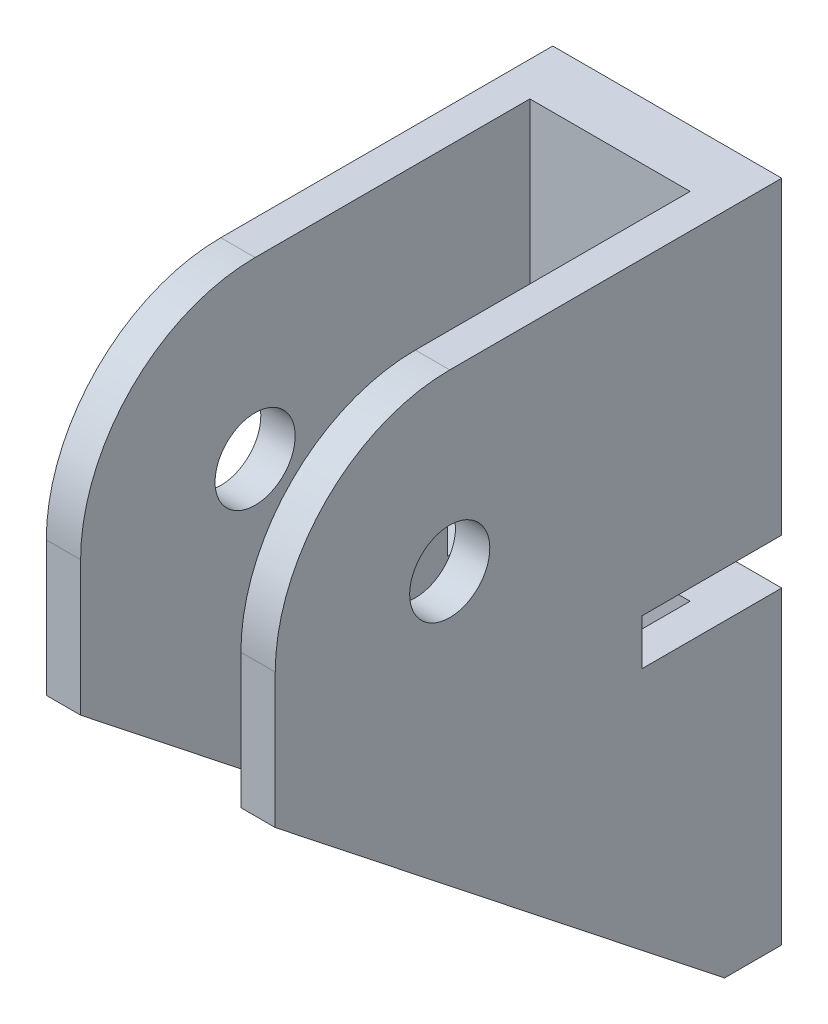
from build123d import *

# Parameters (mm, degrees)
SKETCH1_W             = 10
SKETCH1_H             = 13.5
SKETCH1_R             = 1.75
BOSS_EXTRUDE1_DEPTH   = 2.5
BOSS_EXTRUDE1_2_DEPTH = 2.5
BOSS_EXTRUDE2_DEPTH   = 1.5
SKETCH5_R             = 1.7499965
CUT_EXTRUDE1_DEPTH    = 12.446


with BuildPart() as part:
    # Sketch1 → Boss-Extrude1 (new body)
    with BuildSketch(Plane.XY):
        with Locations((8.63063628, 74.671921363)):
            Rectangle(SKETCH1_W, SKETCH1_H)
        with Locations((8.63063628, 74.421921363)):
            Circle(SKETCH1_R, mode=Mode.SUBTRACT)
    extrude(amount=BOSS_EXTRUDE1_DEPTH)



with BuildPart() as body_2:
    # Sketch1 → Boss-Extrude1 2 (new body)
    with BuildSketch(Plane.XY):
        with Locations((8.63063628, 59.171921363)):
            Rectangle(SKETCH1_W, SKETCH1_H)
        with Locations((8.63063628, 59.921921363)):
            Circle(SKETCH1_R, mode=Mode.SUBTRACT)
    extrude(amount=BOSS_EXTRUDE1_2_DEPTH)


with BuildPart() as part_1:
    add(part.part)

    add(body_2.part)  # Boss-Extrude2 merges body 2
    # Sketch2 → Boss-Extrude2 (add)
    with BuildSketch(Plane.ZY.offset(-3.63063628)):
        with BuildLine():
            Line((6.100159914, 65.921921363), (2.5, 65.921921363))
            Line((2.5, 65.921921363), (2.5, 52.421921363))
            Line((2.5, 52.421921363), (22.12, 67.921921363))
            Line((22.12, 67.921921363), (22.12, 73.801921363))
            ThreePointArc((22.12, 73.801921363), (19.888153673, 79.190075036), (14.5, 81.421921363))
            Line((14.5, 81.421921363), (2.5, 81.421921363))
            Line((2.5, 81.421921363), (2.5, 67.921921363))
            Line((2.5, 67.921921363), (6.100159914, 67.921921363))
            Line((6.100159914, 67.921921363), (6.100159914, 65.921921363))
        make_face()
    boss_extrude2 = extrude(amount=-BOSS_EXTRUDE2_DEPTH)

    # Mirror1: Boss-Extrude2 across plane
    add(boss_extrude2.mirror(Plane.ZY.offset(-8.63063628)))

    # Sketch5 → Cut-Extrude1 (cut)
    with BuildSketch(Plane.ZY.offset(-3.63063628)):
        with Locations(Location((14.5, 73.801921363, 0), (0, 0, 270))):
            Circle(SKETCH5_R)
    extrude(amount=-CUT_EXTRUDE1_DEPTH, mode=Mode.SUBTRACT)


solid = part_1.part
